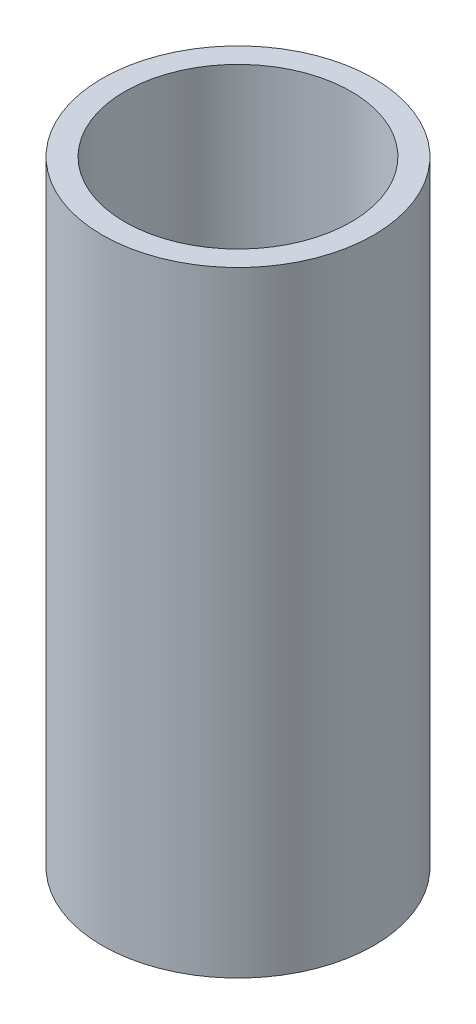
from build123d import *

# Parameters (mm, degrees)
SKETCH1_R           = 9.525
SKETCH1_R_2         = 7.9375
BOSS_EXTRUDE1_DEPTH = 43.18


with BuildPart() as part:
    # Sketch1 → Boss-Extrude1 (new body)
    with BuildSketch(Plane(origin=(0, 0, 0), x_dir=(1, 0, 0), z_dir=(0, 1, 0))):
        with Locations(Location((0, 2.27890667, 0), (0, 0, 270))):
            Circle(SKETCH1_R)
        with Locations(Location((0, 2.27890667, 0), (0, 0, 270))):
            Circle(SKETCH1_R_2, mode=Mode.SUBTRACT)
    extrude(amount=BOSS_EXTRUDE1_DEPTH)


solid = part.part
